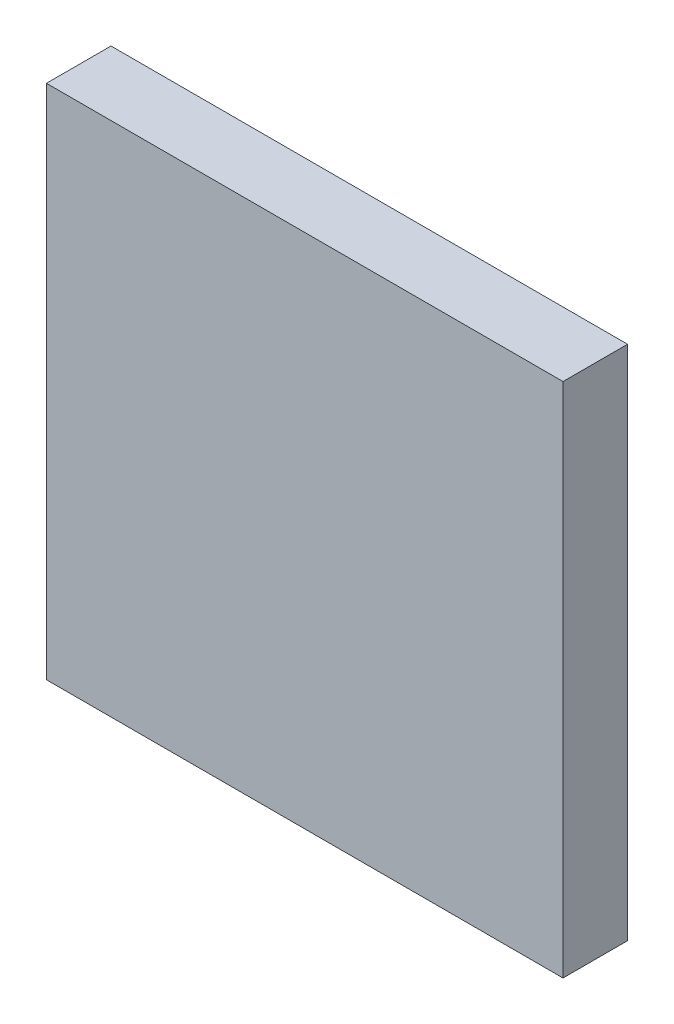
from build123d import *

# Parameters (mm, degrees)
SKETCH1_W           = 400
SKETCH1_H           = 400
BOSS_EXTRUDE1_DEPTH = 50


with BuildPart() as part:
    # Sketch1 → Boss-Extrude1 (new body)
    with BuildSketch(Plane.XY):
        Rectangle(SKETCH1_W, SKETCH1_H)
    extrude(amount=BOSS_EXTRUDE1_DEPTH)


solid = part.part
